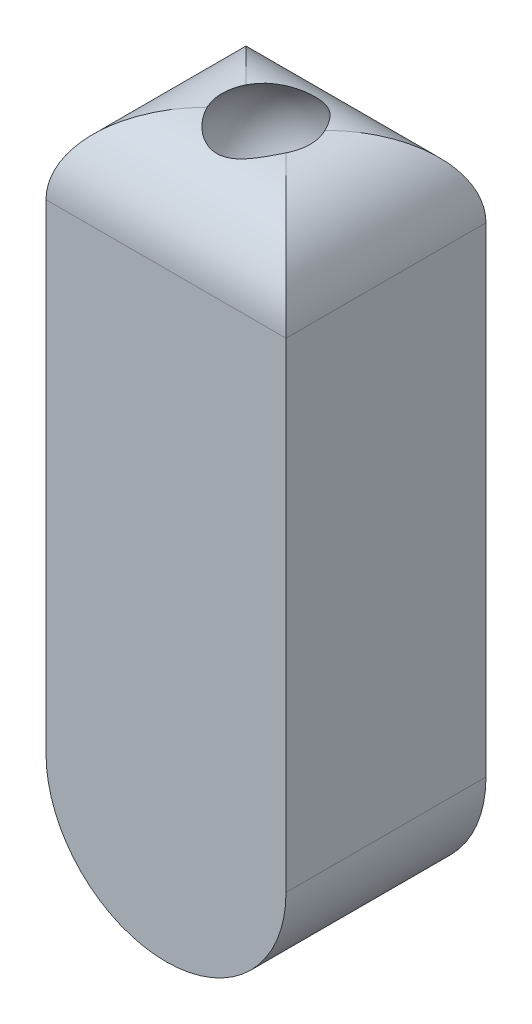
from build123d import *

# Parameters (mm, degrees)
SKETCH1_W           = 76.2
SKETCH1_H           = 177.8
BOSS_EXTRUDE1_DEPTH = 63.5
SKETCH2_R           = 38.1
BOSS_EXTRUDE2_DEPTH = 63.5
SKETCH4_R           = 13.97
CUT_EXTRUDE1_DEPTH  = 48.26
FILLET2_R           = 25.4


with BuildPart() as part:
    # Sketch1 → Boss-Extrude1 (new body)
    with BuildSketch(Plane.XY):
        Rectangle(SKETCH1_W, SKETCH1_H)
    extrude(amount=BOSS_EXTRUDE1_DEPTH)

    # Sketch2 → Boss-Extrude2 (add, through all)
    with BuildSketch(Plane.XY):
        with Locations((0, -88.9)):
            Circle(SKETCH2_R)
    extrude(amount=BOSS_EXTRUDE2_DEPTH)

    # Sketch4 → Cut-Extrude1 (cut)
    with BuildSketch(Plane.XY):
        with Locations(Location((0, -88.9, 0), (0, 0, 180))):
            Circle(SKETCH4_R)
    extrude(amount=CUT_EXTRUDE1_DEPTH, mode=Mode.SUBTRACT)

    # Fillet2
    fillet2_edges = [part.edges().sort_by_distance(p)[0] for p in [
        (0, 88.9, 0),
        (-38.1, 88.9, 31.75),
        (38.1, 88.9, 31.75),
        (0, 88.9, 63.5),
    ]]
    fillet(fillet2_edges, radius=FILLET2_R)

    # Sketch5 → Cut-Revolve4 (revolve, cut)
    with BuildSketch(Plane(origin=(0, 0, 0), x_dir=(0, 0, -1), z_dir=(1, 0, 0))):
        with BuildLine():
            Line((-31.75, 53.823933451), (-31.75, 94.463933451))
            ThreePointArc((-31.75, 94.463933451), (-52.07, 74.143933451), (-31.75, 53.823933451))
        make_face()
    revolve(axis=Axis((0, 53.823933451, 31.75), (0, 1, 0)), mode=Mode.SUBTRACT)


solid = part.part
